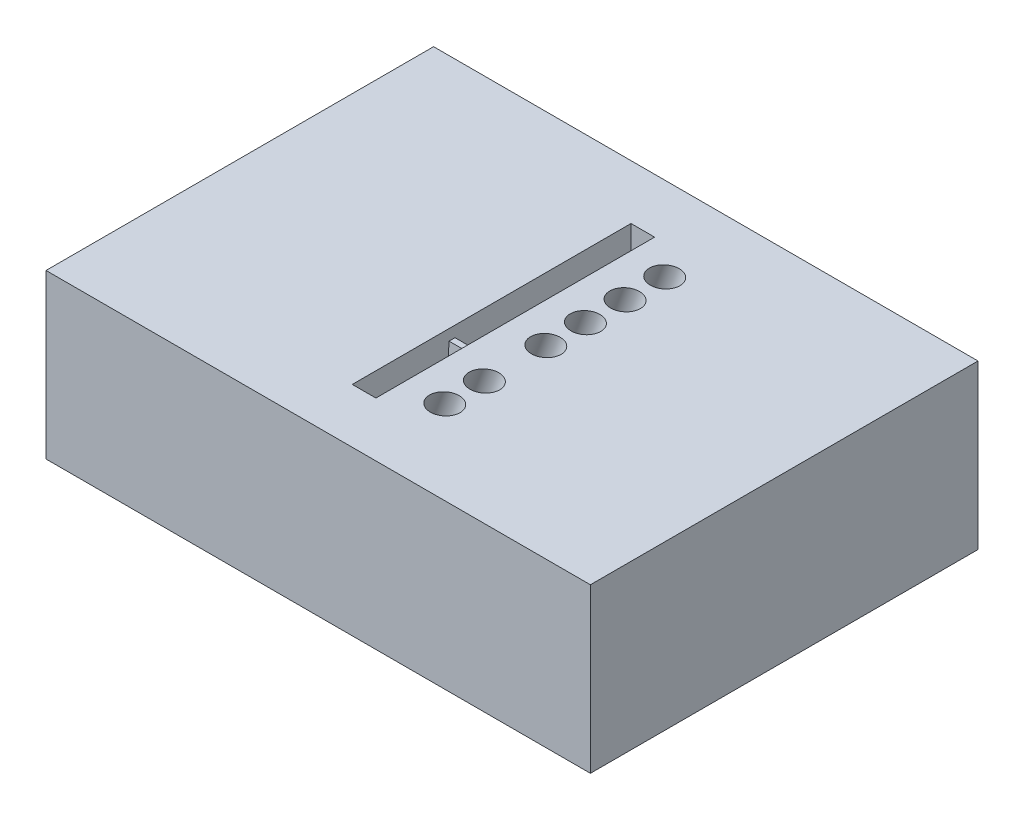
from build123d import *

# Parameters (mm, degrees)
SKETCH1_W                = 50
SKETCH1_H                = 35.6
BOSS_EXTRUDE2_DEPTH      = 15
SKETCH9_W                = 2.17
SKETCH9_H                = 25.6
CUT_EXTRUDE1_DEPTH       = 10.3
SKETCH7_R                = 1.32
CUT_EXTRUDE2_DEPTH       = 34.770899441
SKETCH10_R               = 0.81
CUT_EXTRUDE3_DEPTH       = 8
BOSS_EXTRUDE3_DEPTH      = 0.3
BOSS_EXTRUDE3_DEPTH_BACK = 1.87


with BuildPart() as part:
    # Sketch1 → Boss-Extrude2 (new body)
    with BuildSketch(Plane(origin=(0, 0, 0), x_dir=(1, 0, 0), z_dir=(0, 1, 0))):
        Rectangle(SKETCH1_W, SKETCH1_H)
    extrude(amount=-BOSS_EXTRUDE2_DEPTH)

    # Sketch9 → Cut-Extrude1 (cut)
    with BuildSketch(Plane(origin=(0, 0, 0), x_dir=(1, 0, 0), z_dir=(0, 1, 0))):
        with Locations((-0.785, 0)):
            Rectangle(SKETCH9_W, SKETCH9_H)
    extrude(amount=-CUT_EXTRUDE1_DEPTH, mode=Mode.SUBTRACT)

    # Sketch7 → Cut-Extrude2 (cut, through all)
    with BuildSketch(Plane(origin=(-1.180715955, -3.243990424, 0), x_dir=(-0.9396926207859082, 0.3420201433256691, 0), z_dir=(-0.3420201433256691, -0.9396926207859082, 0))):
        with Locations(Location((-3.68818129, 10.1, 0), (0, 0, 180))):
            Circle(SKETCH7_R)
        with Locations(Location((-3.68818129, 6.46, 0), (0, 0, 180))):
            Circle(SKETCH7_R)
        with Locations(Location((-3.68818129, 2.82, 0), (0, 0, 180))):
            Circle(SKETCH7_R)
        with Locations(Location((-3.68818129, -0.82, 0), (0, 0, 180))):
            Circle(SKETCH7_R)
        with Locations(Location((-3.68818129, -6.46, 0), (0, 0, 180))):
            Circle(SKETCH7_R)
        with Locations(Location((-3.68818129, -10.1, 0), (0, 0, 180))):
            Circle(SKETCH7_R)
    extrude(amount=-CUT_EXTRUDE2_DEPTH, mode=Mode.SUBTRACT)

    # Sketch10 → Cut-Extrude3 (cut)
    with BuildSketch(Plane(origin=(-1.180715955, -3.243990424, 0), x_dir=(-0.9396926207859082, 0.3420201433256691, 0), z_dir=(-0.3420201433256691, -0.9396926207859082, 0))):
        with Locations(Location((-3.68818129, -10.1, 0), (0, 0, 180))):
            Circle(SKETCH10_R)
        with Locations(Location((-3.68818129, -6.46, 0), (0, 0, 180))):
            Circle(SKETCH10_R)
        with Locations(Location((-3.68818129, -0.82, 0), (0, 0, 180))):
            Circle(SKETCH10_R)
        with Locations(Location((-3.68818129, 2.82, 0), (0, 0, 180))):
            Circle(SKETCH10_R)
        with Locations(Location((-3.68818129, 6.46, 0), (0, 0, 180))):
            Circle(SKETCH10_R)
        with Locations(Location((-3.68818129, 10.1, 0), (0, 0, 180))):
            Circle(SKETCH10_R)
    extrude(amount=CUT_EXTRUDE3_DEPTH, mode=Mode.SUBTRACT)

    # Sketch11 → Boss-Extrude3 (add, two sides: drawn at the far end of the back side and taken through both)
    with BuildSketch(Plane(origin=(0, 0, 0), x_dir=(0, 0, -1), z_dir=(1, 0, 0)).offset(-BOSS_EXTRUDE3_DEPTH_BACK)):
        Polygon((-4.40036814, -10.3), (-2.87963186, -10.3), (-3.367024207, -1), (-3.912975793, -1), align=None)
    extrude(amount=BOSS_EXTRUDE3_DEPTH + BOSS_EXTRUDE3_DEPTH_BACK)


solid = part.part
